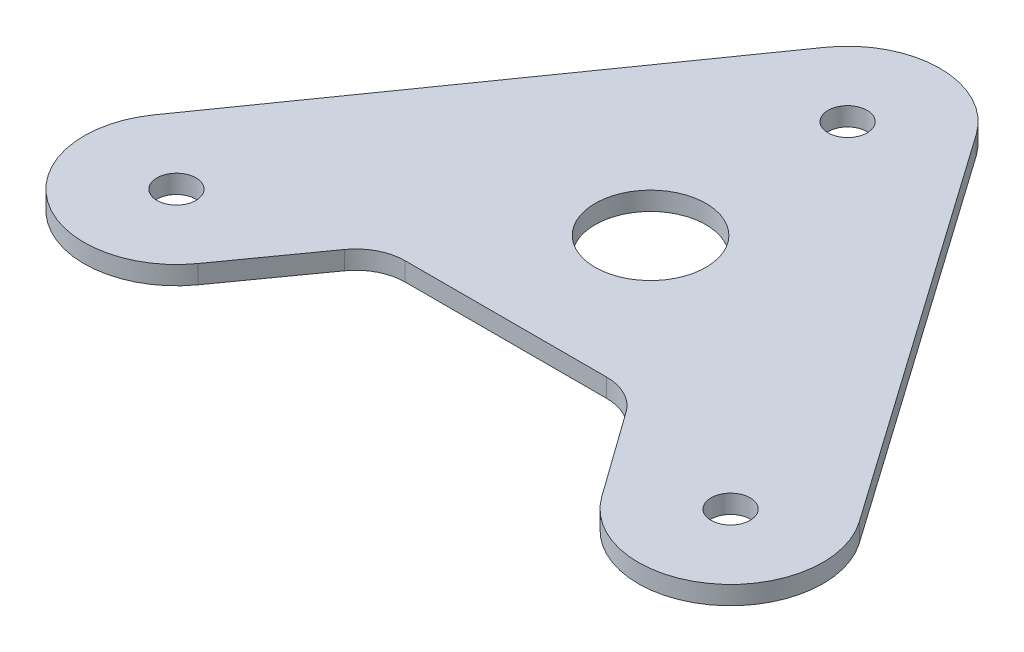
from build123d import *

# Parameters (mm, degrees)
SKETCH1_R           = 9
SKETCH1_R_2         = 3.175
BOSS_EXTRUDE1_DEPTH = 3


with BuildPart() as part:
    # Sketch1 → Boss-Extrude1 (new body)
    with BuildSketch(Plane(origin=(0, 0, 0), x_dir=(1, 0, 0), z_dir=(0, 1, 0))):
        with BuildLine():
            Line((-12.270437376, 20.928622154), (-57.270437376, -43.071377846))
            ThreePointArc((-57.270437376, -43.071377846), (-53.677181673, -63.93449063), (-32.7997143, -60.425599405))
            Line((-32.7997143, -60.425599405), (-22.871154784, -46.544858311))
            ThreePointArc((-22.871154784, -46.544858311), (-20.022657317, -44.084488856), (-16.364335743, -43.199029126))
            Line((-16.364335743, -43.199029126), (16.364335743, -43.199029126))
            ThreePointArc((16.364335743, -43.199029126), (20.022657317, -44.084488856), (22.871154784, -46.544858311))
            Line((22.871154784, -46.544858311), (32.7997143, -60.425599405))
            ThreePointArc((32.7997143, -60.425599405), (53.677181673, -63.93449063), (57.270437376, -43.071377846))
            Line((57.270437376, -43.071377846), (12.270437376, 20.928622154))
            ThreePointArc((12.270437376, 20.928622154), (0, 27.300970874), (-12.270437376, 20.928622154))
        make_face()
        with Locations(Location((0, -19.699029126, 0), (0, 0, 270))):
            Circle(SKETCH1_R, mode=Mode.SUBTRACT)
        with Locations(Location((-45, -51.699029126, 0), (0, 0, 270))):
            Circle(SKETCH1_R_2, mode=Mode.SUBTRACT)
        with Locations(Location((0, 12.300970874, 0), (0, 0, 270))):
            Circle(SKETCH1_R_2, mode=Mode.SUBTRACT)
        with Locations(Location((45, -51.699029126, 0), (0, 0, 270))):
            Circle(SKETCH1_R_2, mode=Mode.SUBTRACT)
    extrude(amount=BOSS_EXTRUDE1_DEPTH)


solid = part.part
